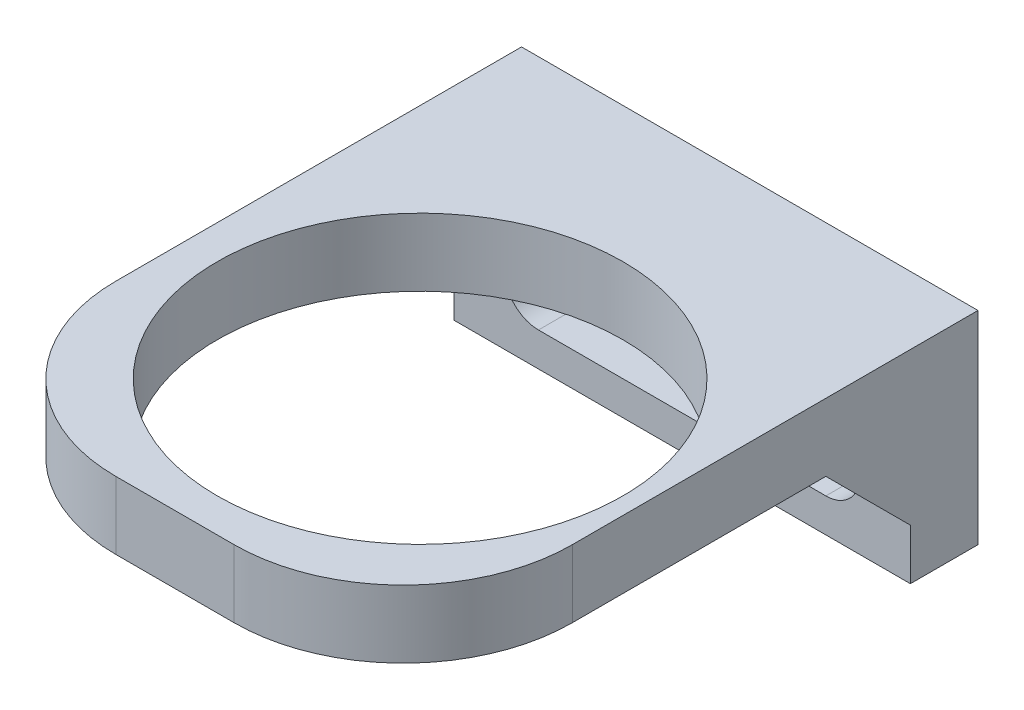
from build123d import *

# Parameters (mm, degrees)
ESQUISSE1_W             = 27
ESQUISSE1_H             = 34
ESQUISSE1_R             = 12
BOSS_EXTRU_1_DEPTH      = 4
ESQUISSE2_W             = 27
ESQUISSE2_H             = 4
BOSS_EXTRU_2_DEPTH      = 8
BOSS_EXTRU_3_DEPTH      = 2
BOSS_EXTRU_4_DEPTH      = 2
CONG_1_R                = 10
ENL_V_MAT_EXTRU_1_DEPTH = 35.058772732


with BuildPart() as part:
    # Esquisse1 → Boss.-Extru.1 (new body)
    with BuildSketch(Plane(origin=(0, 0, 0), x_dir=(1, 0, 0), z_dir=(0, 1, 0))):
        with Locations((-0.5, 3)):
            Rectangle(ESQUISSE1_W, ESQUISSE1_H)
        with Locations(Location((0, 0, 0), (0, 0, 270))):
            Circle(ESQUISSE1_R, mode=Mode.SUBTRACT)
    extrude(amount=BOSS_EXTRU_1_DEPTH)

    # Esquisse2 → Boss.-Extru.2 (add)
    with BuildSketch(Plane.XZ):
        with Locations((-0.5, -18)):
            Rectangle(ESQUISSE2_W, ESQUISSE2_H)
    extrude(amount=BOSS_EXTRU_2_DEPTH)

    # Esquisse5 → Boss.-Extru.3 (add)
    with BuildSketch(Plane.ZY.offset(14)):
        Polygon((-16, 0), (-16, -5), (-11, 0), align=None)
    extrude(amount=-BOSS_EXTRU_3_DEPTH)

    # Esquisse6 → Boss.-Extru.4 (add)
    with BuildSketch(Plane(origin=(13, 0, 0), x_dir=(0, 0, -1), z_dir=(1, 0, 0))):
        Polygon((16, 0), (11, 0), (16, -5), align=None)
    extrude(amount=-BOSS_EXTRU_4_DEPTH)

    # Congé1
    cong_1_edges = [part.edges().sort_by_distance(p)[0] for p in [
        (-14, 2, 14),
        (13, 2, 14),
    ]]
    fillet(cong_1_edges, radius=CONG_1_R)

    # Esquisse7 → Enlèv. mat.-Extru.1 (cut, through all)
    with BuildSketch(Plane.XY.offset(-16)):
        with BuildLine():
            Line((-9, -2), (8, -2))
            ThreePointArc((8, -2), (10, -4), (8, -6))
            Line((8, -6), (-9, -6))
            ThreePointArc((-9, -6), (-11, -4), (-9, -2))
        make_face()
    extrude(amount=-ENL_V_MAT_EXTRU_1_DEPTH, mode=Mode.SUBTRACT)


solid = part.part
